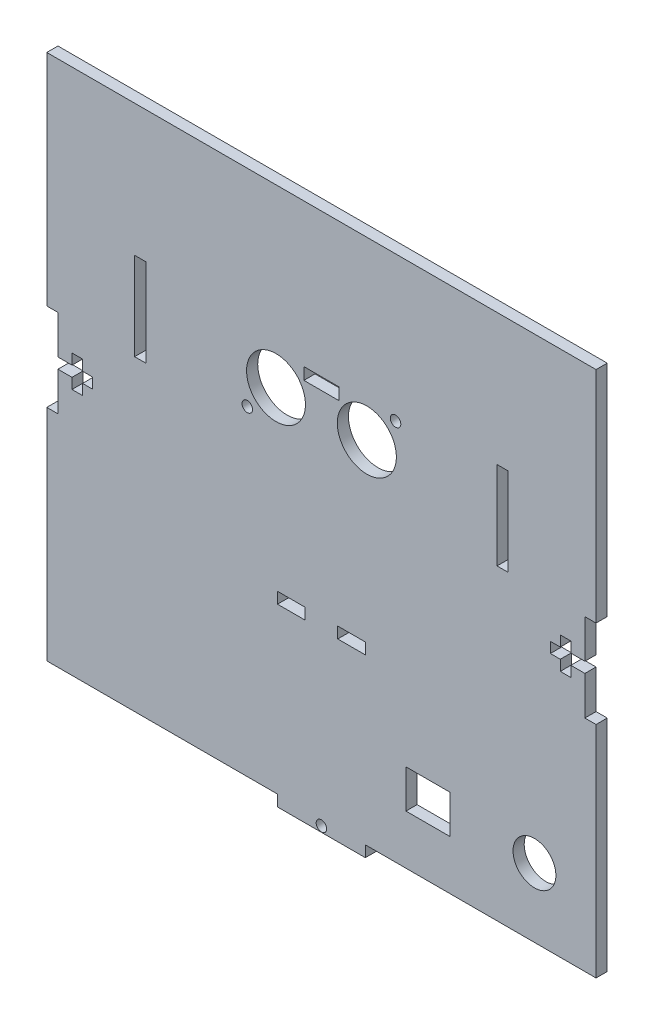
from build123d import *

# Parameters (mm, degrees)
SKETCH1_R           = 1.5
BOSS_EXTRUDE1_DEPTH = 3.18
SKETCH2_R           = 6.1
SKETCH2_W           = 12.570473208
SKETCH2_H           = 10.91819785
CUT_EXTRUDE1_DEPTH  = 20
SKETCH4_R           = 8.384981778
SKETCH4_R_2         = 8.410411153
SKETCH4_W           = 9.999333355
SKETCH4_H           = 3.400001112
CUT_EXTRUDE2_DEPTH  = 10
SKETCH5_W           = 3.18
SKETCH5_H           = 25
SKETCH5_W_2         = 7.85
SKETCH5_H_2         = 3.18
CUT_EXTRUDE3_DEPTH  = 10
SKETCH8_R           = 1.5
CUT_EXTRUDE4_DEPTH  = 10


with BuildPart() as part:
    # Sketch1 → Boss-Extrude1 (new body)
    with BuildSketch(Plane.XY):
        Polygon((-78.18, 75), (78.18, 75), (78.18, 12.5), (75, 12.5), (75, 1.5), (71, 1.5), (71, 4.5), (68, 4.5), (68, 1.5), (65.18, 1.5), (65.18, -1.5), (68, -1.5), (68, -4.5), (71, -4.5), (71, -1.5), (75, -1.5), (75, -12.5), (78.18, -12.5), (78.18, -75), (12.5, -75), (12.5, -78.18), (-12.5, -78.18), (-12.5, -75), (-78.18, -75), (-78.18, -12.5), (-75, -12.5), (-75, -1.5), (-71, -1.5), (-71, -4.5), (-68, -4.5), (-68, -1.5), (-65.18, -1.5), (-65.18, 1.5), (-68, 1.5), (-68, 4.5), (-71, 4.5), (-71, 1.5), (-75, 1.5), (-75, 12.5), (-78.18, 12.5), align=None)
        with Locations(Location((0, -76.59, 0), (0, 0, 180))):
            Circle(SKETCH1_R, mode=Mode.SUBTRACT)
    extrude(amount=BOSS_EXTRUDE1_DEPTH)

    # Sketch2 → Cut-Extrude1 (cut)
    with BuildSketch(Plane.XY.offset(3.18)):
        with Locations((60.647779645, -55.45)):
            Circle(SKETCH2_R)
        with Locations((30.347779645, -55.45)):
            Rectangle(SKETCH2_W, SKETCH2_H)
    extrude(amount=-CUT_EXTRUDE1_DEPTH, mode=Mode.SUBTRACT)

    # Sketch4 → Cut-Extrude2 (cut)
    with BuildSketch(Plane.XY.offset(3.18)):
        with Locations((-12.93, 25)):
            Circle(SKETCH4_R)
        with Locations((12.93, 25)):
            Circle(SKETCH4_R_2)
        with Locations((0.003828225, 32.45)):
            Rectangle(SKETCH4_W, SKETCH4_H)
    extrude(amount=-CUT_EXTRUDE2_DEPTH, mode=Mode.SUBTRACT)

    # Sketch5 → Cut-Extrude3 (cut)
    with BuildSketch(Plane(origin=(0, 0, 0), x_dir=(-1, 0, 0), z_dir=(0, 0, -1))):
        with Locations((51.59, 25)):
            Rectangle(SKETCH5_W, SKETCH5_H)
        with Locations((-8.575, -26.59)):
            Rectangle(SKETCH5_W_2, SKETCH5_H_2)
        with Locations((8.575, -26.59)):
            Rectangle(SKETCH5_W_2, SKETCH5_H_2)
        with Locations((-51.59, 25)):
            Rectangle(SKETCH5_W, SKETCH5_H)
    extrude(amount=-CUT_EXTRUDE3_DEPTH, mode=Mode.SUBTRACT)

    # Sketch8 → Cut-Extrude4 (cut)
    with BuildSketch(Plane(origin=(0, 0, 0), x_dir=(-1, 0, 0), z_dir=(0, 0, -1))):
        with Locations((21.1, 16.25)):
            Circle(SKETCH8_R)
        with Locations((-21.1, 33.75)):
            Circle(SKETCH8_R)
    extrude(amount=-CUT_EXTRUDE4_DEPTH, mode=Mode.SUBTRACT)


solid = part.part
